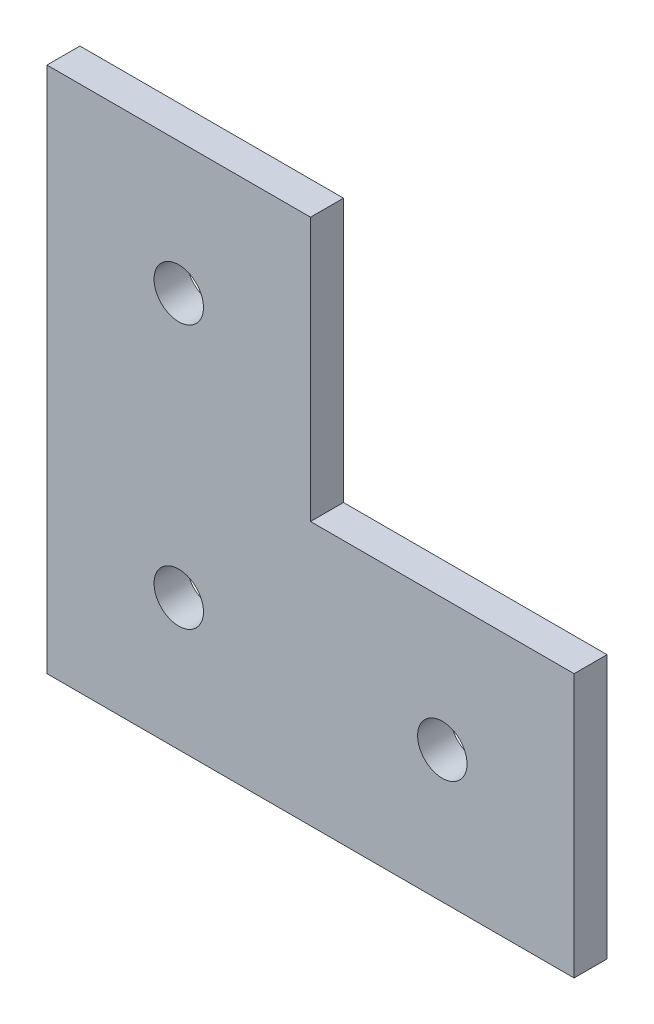
from build123d import *

# Parameters (mm, degrees)
SKETCH1_R           = 2.38125
BOSS_EXTRUDE1_DEPTH = 3.175


with BuildPart() as part:
    # Sketch1 → Boss-Extrude1 (new body)
    with BuildSketch(Plane.XY):
        Polygon((0, 50.8), (0, 0), (50.8, 0), (50.8, 25.4), (25.4, 25.4), (25.4, 50.8), align=None)
        with Locations((12.7, 12.7)):
            Circle(SKETCH1_R, mode=Mode.SUBTRACT)
        with Locations((38.1, 12.7)):
            Circle(SKETCH1_R, mode=Mode.SUBTRACT)
        with Locations((12.7, 38.1)):
            Circle(SKETCH1_R, mode=Mode.SUBTRACT)
    extrude(amount=BOSS_EXTRUDE1_DEPTH)


solid = part.part
